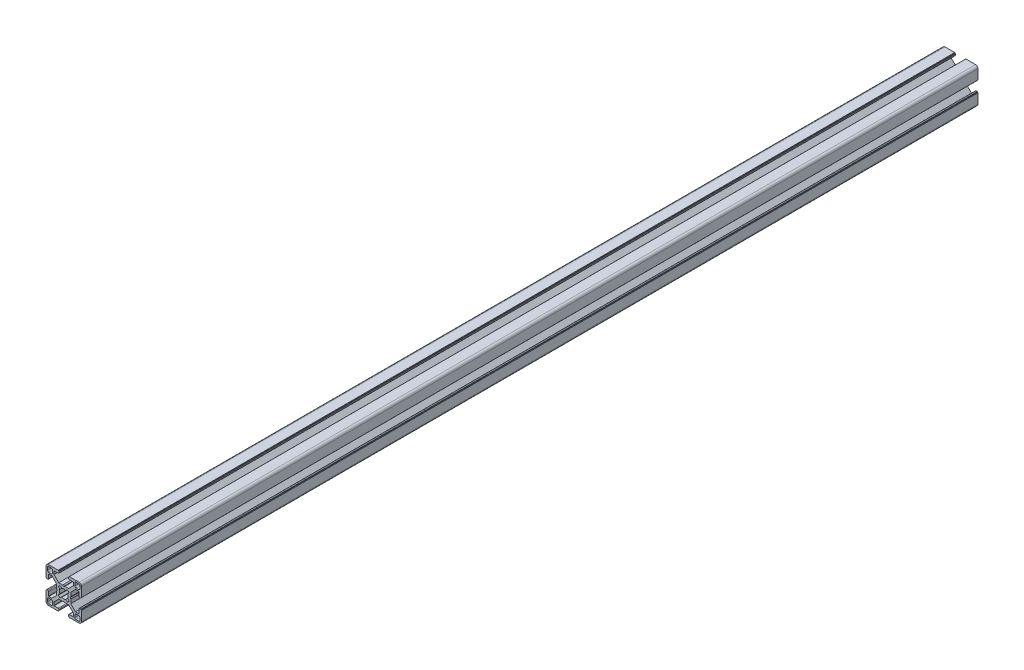
from build123d import *

# Parameters (mm, degrees)
EXTRUDE_1_DEPTH = 760


with BuildPart() as part:
    # 草图1 → 凸台-拉伸1 (new body)
    with BuildSketch(Plane.XY.offset(25)):
        with BuildLine():
            Line((-4.05, 13.399999434), (-4.05, 14.299999626))
            ThreePointArc((-4.05, 14.299999626), (-4.108578753, 14.441421247), (-4.250000374, 14.5))
            Line((-4.250000374, 14.5), (-4.350000144, 14.5))
            ThreePointArc((-4.350000144, 14.5), (-4.49142109, 14.558578474), (-4.549999564, 14.69999942))
            Line((-4.549999564, 14.69999942), (-4.549999564, 14.799999619))
            ThreePointArc((-4.549999564, 14.799999619), (-4.60857832, 14.941421245), (-4.749999945, 15))
            Line((-4.749999945, 15), (-13.000000346, 15))
            ThreePointArc((-13.000000346, 15), (-14.414213664, 14.414213664), (-15, 13.000000346))
            Line((-15, 13.000000346), (-15, 4.749999521))
            ThreePointArc((-15, 4.749999521), (-14.941421273, 4.608577964), (-14.799999716, 4.549999237))
            Line((-14.799999716, 4.549999237), (-14.700000611, 4.549999237))
            ThreePointArc((-14.700000611, 4.549999237), (-14.558579054, 4.49142051), (-14.500000327, 4.349998953))
            Line((-14.500000327, 4.349998953), (-14.500000327, 4.249999521))
            ThreePointArc((-14.500000327, 4.249999521), (-14.4414216, 4.108577964), (-14.300000043, 4.049999237))
            Line((-14.300000043, 4.049999237), (-13.39999994, 4.049999237))
            ThreePointArc((-13.39999994, 4.049999237), (-12.975735606, 4.225735278), (-12.799999564, 4.649999613))
            Line((-12.799999564, 4.649999613), (-12.799999564, 8.049999716))
            ThreePointArc((-12.799999564, 8.049999716), (-12.741420837, 8.191421273), (-12.59999928, 8.25))
            Line((-12.59999928, 8.25), (-10.049999564, 8.25))
            Line((-10.049999564, 8.25), (-6.00446543, 4.204465866))
            Line((-6.00446543, 4.204465866), (-6.00446543, 0.899999619))
            Line((-6.00446543, 0.899999619), (-5.484852164, 0))
            Line((-5.484852164, 0), (-6.00446543, -0.899999619))
            Line((-6.00446543, -0.899999619), (-6.00446543, -4.204465866))
            Line((-6.00446543, -4.204465866), (-10.049999564, -8.25))
            Line((-10.049999564, -8.25), (-12.59999928, -8.25))
            ThreePointArc((-12.59999928, -8.25), (-12.741420837, -8.191421273), (-12.799999564, -8.049999716))
            Line((-12.799999564, -8.049999716), (-12.799999564, -4.649999613))
            ThreePointArc((-12.799999564, -4.649999613), (-12.975735606, -4.225735278), (-13.39999994, -4.049999237))
            Line((-13.39999994, -4.049999237), (-14.300000043, -4.049999237))
            ThreePointArc((-14.300000043, -4.049999237), (-14.4414216, -4.108577964), (-14.500000327, -4.249999521))
            Line((-14.500000327, -4.249999521), (-14.500000327, -4.349998953))
            ThreePointArc((-14.500000327, -4.349998953), (-14.558579054, -4.49142051), (-14.700000611, -4.549999237))
            Line((-14.700000611, -4.549999237), (-14.799999716, -4.549999237))
            ThreePointArc((-14.799999716, -4.549999237), (-14.941421273, -4.608577964), (-15, -4.749999521))
            Line((-15, -4.749999521), (-15, -13.000000346))
            ThreePointArc((-15, -13.000000346), (-14.414213664, -14.414213664), (-13.000000346, -15))
            Line((-13.000000346, -15), (-4.749999945, -15))
            ThreePointArc((-4.749999945, -15), (-4.60857832, -14.941421245), (-4.549999564, -14.799999619))
            Line((-4.549999564, -14.799999619), (-4.549999564, -14.69999942))
            ThreePointArc((-4.549999564, -14.69999942), (-4.49142109, -14.558578474), (-4.350000144, -14.5))
            Line((-4.350000144, -14.5), (-4.250000374, -14.5))
            ThreePointArc((-4.250000374, -14.5), (-4.108578753, -14.441421247), (-4.05, -14.299999626))
            Line((-4.05, -14.299999626), (-4.05, -13.399999434))
            ThreePointArc((-4.05, -13.399999434), (-4.225735989, -12.975735226), (-4.650000197, -12.799999237))
            Line((-4.650000197, -12.799999237), (-8.049999924, -12.799999237))
            ThreePointArc((-8.049999924, -12.799999237), (-8.191421565, -12.741420475), (-8.250000327, -12.599998834))
            Line((-8.250000327, -12.599998834), (-8.250000327, -10.049999237))
            Line((-8.250000327, -10.049999237), (-4.204466193, -6))
            Line((-4.204466193, -6), (-0.899999946, -6))
            Line((-0.899999946, -6), (0, -5.484851837))
            Line((0, -5.484851837), (0.899999946, -6))
            Line((0.899999946, -6), (4.204466193, -6))
            Line((4.204466193, -6), (8.250000327, -10.049999237))
            Line((8.250000327, -10.049999237), (8.250000327, -12.599998834))
            ThreePointArc((8.250000327, -12.599998834), (8.191421565, -12.741420475), (8.049999924, -12.799999237))
            Line((8.049999924, -12.799999237), (4.650000197, -12.799999237))
            ThreePointArc((4.650000197, -12.799999237), (4.225735989, -12.975735226), (4.05, -13.399999434))
            Line((4.05, -13.399999434), (4.05, -14.299999626))
            ThreePointArc((4.05, -14.299999626), (4.108578753, -14.441421247), (4.250000374, -14.5))
            Line((4.250000374, -14.5), (4.350000144, -14.5))
            ThreePointArc((4.350000144, -14.5), (4.49142109, -14.558578474), (4.549999564, -14.69999942))
            Line((4.549999564, -14.69999942), (4.549999564, -14.799999619))
            ThreePointArc((4.549999564, -14.799999619), (4.60857832, -14.941421245), (4.749999945, -15))
            Line((4.749999945, -15), (13.000000346, -15))
            ThreePointArc((13.000000346, -15), (14.414213664, -14.414213664), (15, -13.000000346))
            Line((15, -13.000000346), (15, -4.749999521))
            ThreePointArc((15, -4.749999521), (14.941421273, -4.608577964), (14.799999716, -4.549999237))
            Line((14.799999716, -4.549999237), (14.700000611, -4.549999237))
            ThreePointArc((14.700000611, -4.549999237), (14.558579054, -4.49142051), (14.500000327, -4.349998953))
            Line((14.500000327, -4.349998953), (14.500000327, -4.249999521))
            ThreePointArc((14.500000327, -4.249999521), (14.4414216, -4.108577964), (14.300000043, -4.049999237))
            Line((14.300000043, -4.049999237), (13.39999994, -4.049999237))
            ThreePointArc((13.39999994, -4.049999237), (12.975735606, -4.225735278), (12.799999564, -4.649999613))
            Line((12.799999564, -4.649999613), (12.799999564, -8.049999716))
            ThreePointArc((12.799999564, -8.049999716), (12.741420837, -8.191421273), (12.59999928, -8.25))
            Line((12.59999928, -8.25), (10.049999564, -8.25))
            Line((10.049999564, -8.25), (6.00446543, -4.204465866))
            Line((6.00446543, -4.204465866), (6.00446543, -0.899999619))
            Line((6.00446543, -0.899999619), (5.484852164, 0))
            Line((5.484852164, 0), (6.00446543, 0.899999619))
            Line((6.00446543, 0.899999619), (6.00446543, 4.204465866))
            Line((6.00446543, 4.204465866), (10.049999564, 8.25))
            Line((10.049999564, 8.25), (12.59999928, 8.25))
            ThreePointArc((12.59999928, 8.25), (12.741420837, 8.191421273), (12.799999564, 8.049999716))
            Line((12.799999564, 8.049999716), (12.799999564, 4.649999613))
            ThreePointArc((12.799999564, 4.649999613), (12.975735606, 4.225735278), (13.39999994, 4.049999237))
            Line((13.39999994, 4.049999237), (14.300000043, 4.049999237))
            ThreePointArc((14.300000043, 4.049999237), (14.4414216, 4.108577964), (14.500000327, 4.249999521))
            Line((14.500000327, 4.249999521), (14.500000327, 4.349998953))
            ThreePointArc((14.500000327, 4.349998953), (14.558579054, 4.49142051), (14.700000611, 4.549999237))
            Line((14.700000611, 4.549999237), (14.799999716, 4.549999237))
            ThreePointArc((14.799999716, 4.549999237), (14.941421273, 4.608577964), (15, 4.749999521))
            Line((15, 4.749999521), (15, 13.000000346))
            ThreePointArc((15, 13.000000346), (14.414213664, 14.414213664), (13.000000346, 15))
            Line((13.000000346, 15), (4.749999945, 15))
            ThreePointArc((4.749999945, 15), (4.60857832, 14.941421245), (4.549999564, 14.799999619))
            Line((4.549999564, 14.799999619), (4.549999564, 14.69999942))
            ThreePointArc((4.549999564, 14.69999942), (4.49142109, 14.558578474), (4.350000144, 14.5))
            Line((4.350000144, 14.5), (4.250000374, 14.5))
            ThreePointArc((4.250000374, 14.5), (4.108578753, 14.441421247), (4.05, 14.299999626))
            Line((4.05, 14.299999626), (4.05, 13.399999434))
            ThreePointArc((4.05, 13.399999434), (4.225735989, 12.975735226), (4.650000197, 12.799999237))
            Line((4.650000197, 12.799999237), (8.049999924, 12.799999237))
            ThreePointArc((8.049999924, 12.799999237), (8.191421565, 12.741420475), (8.250000327, 12.599998834))
            Line((8.250000327, 12.599998834), (8.250000327, 10.049999237))
            Line((8.250000327, 10.049999237), (4.204466193, 6))
            Line((4.204466193, 6), (0.899999946, 6))
            Line((0.899999946, 6), (0, 5.484851837))
            Line((0, 5.484851837), (-0.899999946, 6))
            Line((-0.899999946, 6), (-4.204466193, 6))
            Line((-4.204466193, 6), (-8.250000327, 10.049999237))
            Line((-8.250000327, 10.049999237), (-8.250000327, 12.599998834))
            ThreePointArc((-8.250000327, 12.599998834), (-8.191421565, 12.741420475), (-8.049999924, 12.799999237))
            Line((-8.049999924, 12.799999237), (-4.650000197, 12.799999237))
            ThreePointArc((-4.650000197, 12.799999237), (-4.225735989, 12.975735226), (-4.05, 13.399999434))
        make_face()
        with BuildLine():
            Line((-12.7000011, 13.700000398), (-10.500000318, 13.700000398))
            ThreePointArc((-10.500000318, 13.700000398), (-9.792893543, 13.407107182), (-9.500000327, 12.700000408))
            Line((-9.500000327, 12.700000408), (-9.500000327, 10.499999626))
            ThreePointArc((-9.500000327, 10.499999626), (-9.792893543, 9.792892851), (-10.500000318, 9.499999635))
            Line((-10.500000318, 9.499999635), (-12.7000011, 9.499999635))
            ThreePointArc((-12.7000011, 9.499999635), (-13.407107874, 9.792892851), (-13.70000109, 10.499999626))
            Line((-13.70000109, 10.499999626), (-13.70000109, 12.700000408))
            ThreePointArc((-13.70000109, 12.700000408), (-13.407107874, 13.407107182), (-12.7000011, 13.700000398))
        make_face(mode=Mode.SUBTRACT)
        with BuildLine():
            Line((-10.500000318, -13.700000398), (-12.7000011, -13.700000398))
            ThreePointArc((-12.7000011, -13.700000398), (-13.407107874, -13.407107182), (-13.70000109, -12.700000408))
            Line((-13.70000109, -12.700000408), (-13.70000109, -10.499999626))
            ThreePointArc((-13.70000109, -10.499999626), (-13.407107874, -9.792892851), (-12.7000011, -9.499999635))
            Line((-12.7000011, -9.499999635), (-10.500000318, -9.499999635))
            ThreePointArc((-10.500000318, -9.499999635), (-9.792893543, -9.792892851), (-9.500000327, -10.499999626))
            Line((-9.500000327, -10.499999626), (-9.500000327, -12.700000408))
            ThreePointArc((-9.500000327, -12.700000408), (-9.792893543, -13.407107182), (-10.500000318, -13.700000398))
        make_face(mode=Mode.SUBTRACT)
        with BuildLine():
            Line((10.500000318, 13.700000398), (12.7000011, 13.700000398))
            ThreePointArc((12.7000011, 13.700000398), (13.407107874, 13.407107182), (13.70000109, 12.700000408))
            Line((13.70000109, 12.700000408), (13.70000109, 10.499999626))
            ThreePointArc((13.70000109, 10.499999626), (13.407107874, 9.792892851), (12.7000011, 9.499999635))
            Line((12.7000011, 9.499999635), (10.500000318, 9.499999635))
            ThreePointArc((10.500000318, 9.499999635), (9.792893543, 9.792892851), (9.500000327, 10.499999626))
            Line((9.500000327, 10.499999626), (9.500000327, 12.700000408))
            ThreePointArc((9.500000327, 12.700000408), (9.792893543, 13.407107182), (10.500000318, 13.700000398))
        make_face(mode=Mode.SUBTRACT)
        with BuildLine():
            Line((13.70000109, -10.499999626), (13.70000109, -12.700000408))
            ThreePointArc((13.70000109, -12.700000408), (13.407107874, -13.407107182), (12.7000011, -13.700000398))
            Line((12.7000011, -13.700000398), (10.500000318, -13.700000398))
            ThreePointArc((10.500000318, -13.700000398), (9.792893543, -13.407107182), (9.500000327, -12.700000408))
            Line((9.500000327, -12.700000408), (9.500000327, -10.499999626))
            ThreePointArc((9.500000327, -10.499999626), (9.792893543, -9.792892851), (10.500000318, -9.499999635))
            Line((10.500000318, -9.499999635), (12.7000011, -9.499999635))
            ThreePointArc((12.7000011, -9.499999635), (13.407107874, -9.792892851), (13.70000109, -10.499999626))
        make_face(mode=Mode.SUBTRACT)
        with BuildLine():
            Line((-3.135929412, 4.518400903), (-1.600129524, 3.280561767))
            ThreePointArc((-1.600129524, 3.280561767), (0, 3.65), (1.600129524, 3.280561767))
            Line((1.600129524, 3.280561767), (3.135929412, 4.518400903))
            ThreePointArc((3.135929412, 4.518400903), (3.881002259, 3.897155561), (4.505336892, 3.154669473))
            Line((4.505336892, 3.154669473), (3.280561732, 1.600129597))
            ThreePointArc((3.280561732, 1.600129597), (3.65, 0), (3.280561732, -1.600129597))
            Line((3.280561732, -1.600129597), (4.505336892, -3.154669473))
            ThreePointArc((4.505336892, -3.154669473), (3.881002259, -3.897155561), (3.135929412, -4.518400903))
            Line((3.135929412, -4.518400903), (1.600129524, -3.280561767))
            ThreePointArc((1.600129524, -3.280561767), (0, -3.65), (-1.600129524, -3.280561767))
            Line((-1.600129524, -3.280561767), (-3.135929412, -4.518400903))
            ThreePointArc((-3.135929412, -4.518400903), (-3.881002259, -3.897155561), (-4.505336892, -3.154669473))
            Line((-4.505336892, -3.154669473), (-3.280561732, -1.600129597))
            ThreePointArc((-3.280561732, -1.600129597), (-3.65, 0), (-3.280561732, 1.600129597))
            Line((-3.280561732, 1.600129597), (-4.505336892, 3.154669473))
            ThreePointArc((-4.505336892, 3.154669473), (-3.881002259, 3.897155561), (-3.135929412, 4.518400903))
        make_face(mode=Mode.SUBTRACT)
    extrude(amount=-EXTRUDE_1_DEPTH)


solid = part.part
